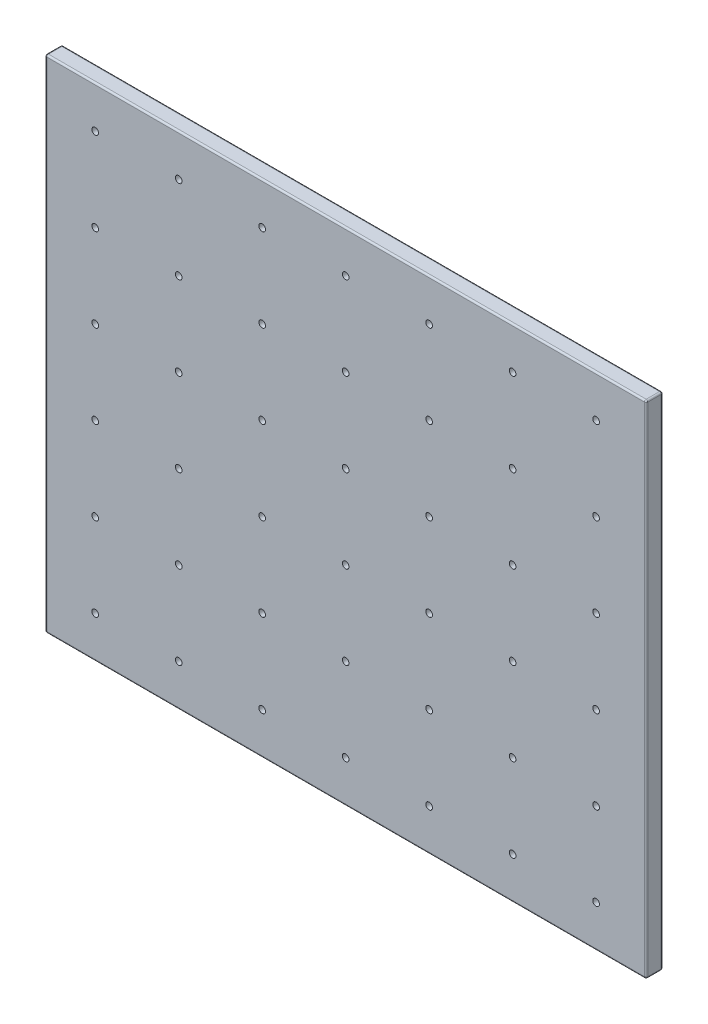
from build123d import *

# Parameters (mm, degrees)
SKETCH1_W               = 720
SKETCH1_H               = 600
BOSS_EXTRUDE1_DEPTH     = 20
FILLET1_R               = 2
CUT_EXTRUDE2_DEPTH      = 470.041575982
CUT_EXTRUDE2_DEPTH_BACK = 419
SKETCH2_R               = 4


with BuildPart() as part:
    # Sketch1 → Boss-Extrude1 (new body)
    with BuildSketch(Plane.XY):
        Rectangle(SKETCH1_W, SKETCH1_H)
    extrude(amount=BOSS_EXTRUDE1_DEPTH)

    # Fillet1
    fillet1_edges = [part.edges().sort_by_distance(p)[0] for p in [
        (360, 0, 20),
        (0, 300, 20),
        (-360, 0, 20),
        (0, 300, 0),
        (360, 0, 0),
        (0, -300, 0),
        (-360, 0, 0),
        (-360, 300, 10),
        (360, 300, 10),
        (360, -300, 10),
        (-360, -300, 10),
        (0, -300, 20),
    ]]
    fillet(fillet1_edges, radius=FILLET1_R)

    # Sketch2 → Cut-Extrude2 (cut, two sides: drawn at the far end of the back side and taken through both)
    with BuildSketch(Plane.XY.offset(20).offset(-CUT_EXTRUDE2_DEPTH_BACK)):
        with Locations((-300, 250)):
            Circle(SKETCH2_R)
        with Locations((-200, 250)):
            Circle(SKETCH2_R)
        with Locations((-100, 250)):
            Circle(SKETCH2_R)
        with Locations((0, 250)):
            Circle(SKETCH2_R)
        with Locations((100, 250)):
            Circle(SKETCH2_R)
        with Locations((200, 250)):
            Circle(SKETCH2_R)
        with Locations((300, 250)):
            Circle(SKETCH2_R)
        with Locations((-200, 150)):
            Circle(SKETCH2_R)
        with Locations((-100, 150)):
            Circle(SKETCH2_R)
        with Locations((0, 150)):
            Circle(SKETCH2_R)
        with Locations((100, 150)):
            Circle(SKETCH2_R)
        with Locations((200, 150)):
            Circle(SKETCH2_R)
        with Locations((300, 150)):
            Circle(SKETCH2_R)
        with Locations((-200, 50)):
            Circle(SKETCH2_R)
        with Locations((-100, 50)):
            Circle(SKETCH2_R)
        with Locations((0, 50)):
            Circle(SKETCH2_R)
        with Locations((100, 50)):
            Circle(SKETCH2_R)
        with Locations((200, 50)):
            Circle(SKETCH2_R)
        with Locations((300, 50)):
            Circle(SKETCH2_R)
        with Locations((-200, -50)):
            Circle(SKETCH2_R)
        with Locations((-100, -50)):
            Circle(SKETCH2_R)
        with Locations((0, -50)):
            Circle(SKETCH2_R)
        with Locations((100, -50)):
            Circle(SKETCH2_R)
        with Locations((200, -50)):
            Circle(SKETCH2_R)
        with Locations((300, -50)):
            Circle(SKETCH2_R)
        with Locations((-200, -150)):
            Circle(SKETCH2_R)
        with Locations((-100, -150)):
            Circle(SKETCH2_R)
        with Locations((0, -150)):
            Circle(SKETCH2_R)
        with Locations((100, -150)):
            Circle(SKETCH2_R)
        with Locations((200, -150)):
            Circle(SKETCH2_R)
        with Locations((300, -150)):
            Circle(SKETCH2_R)
        with Locations((-300, 150)):
            Circle(SKETCH2_R)
        with Locations((-300, 50)):
            Circle(SKETCH2_R)
        with Locations((-300, -50)):
            Circle(SKETCH2_R)
        with Locations((-300, -150)):
            Circle(SKETCH2_R)
        with Locations((-300, -250)):
            Circle(SKETCH2_R)
        with Locations((-200, -250)):
            Circle(SKETCH2_R)
        with Locations((-100, -250)):
            Circle(SKETCH2_R)
        with Locations((0, -250)):
            Circle(SKETCH2_R)
        with Locations((100, -250)):
            Circle(SKETCH2_R)
        with Locations((200, -250)):
            Circle(SKETCH2_R)
        with Locations((300, -250)):
            Circle(SKETCH2_R)
    extrude(amount=CUT_EXTRUDE2_DEPTH + CUT_EXTRUDE2_DEPTH_BACK, mode=Mode.SUBTRACT)


solid = part.part
